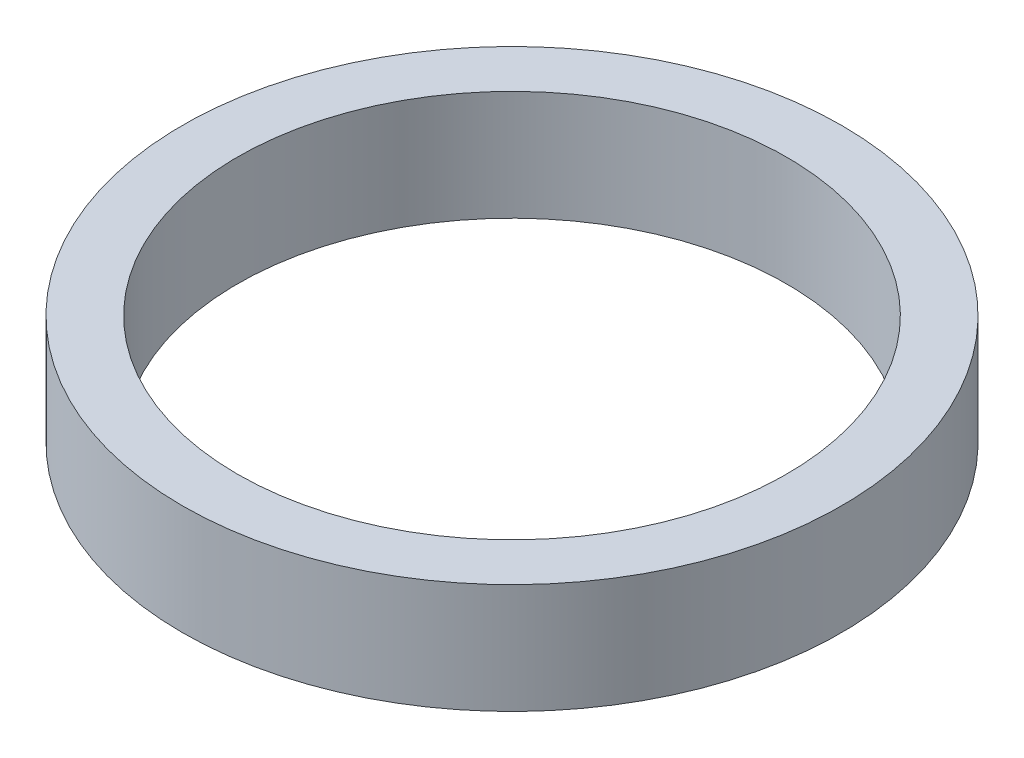
from build123d import *

# Parameters (mm, degrees)
SKETCH1_R           = 15.24
BOSS_EXTRUDE1_DEPTH = 5.08
SKETCH2_R           = 12.7
CUT_EXTRUDE1_DEPTH  = 5.08


with BuildPart() as part:
    # Sketch1 → Boss-Extrude1 (new body)
    with BuildSketch(Plane(origin=(0, 0, 0), x_dir=(1, 0, 0), z_dir=(0, 1, 0))):
        with Locations(Location((0, 0, 0), (0, 0, 270))):
            Circle(SKETCH1_R)
    extrude(amount=BOSS_EXTRUDE1_DEPTH)

    # Sketch2 → Cut-Extrude1 (cut)
    with BuildSketch(Plane(origin=(0, 5.08, 0), x_dir=(1, 0, 0), z_dir=(0, 1, 0))):
        with Locations(Location((0, 0, 0), (0, 0, 270))):
            Circle(SKETCH2_R)
    extrude(amount=-CUT_EXTRUDE1_DEPTH, mode=Mode.SUBTRACT)


solid = part.part
